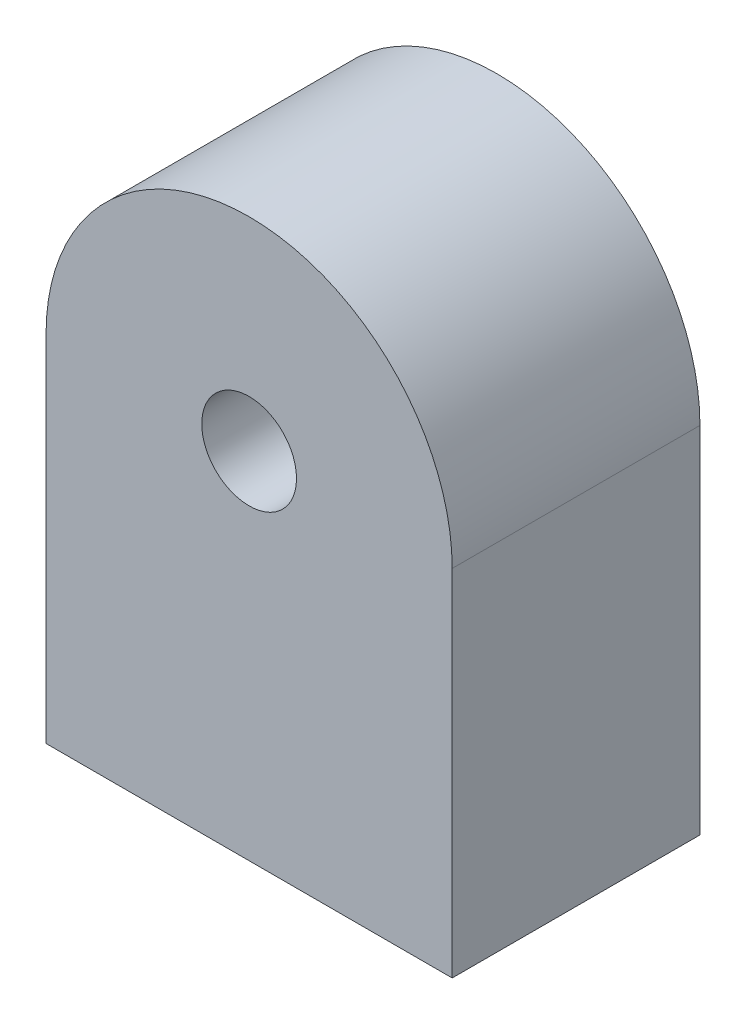
from build123d import *

# Parameters (mm, degrees)
BOSS_EXTRU_1_DEPTH      = 18.3
ESQUISSE2_W             = 14.5
ESQUISSE2_H             = 7.1
ENL_V_MAT_EXTRU_1_DEPTH = 1
ESQUISSE3_W             = 0.64
ESQUISSE3_H             = 0.64
BOSS_EXTRU_2_DEPTH      = 1
ESQUISSE4_R             = 3.5
ENL_V_MAT_EXTRU_2_DEPTH = 37.735541373


with BuildPart() as part:
    # Esquisse1 → Boss.-Extru.1 (new body)
    with BuildSketch(Plane.XY):
        with BuildLine():
            Line((-15, 13.1), (-15, -13.1))
            Line((-15, -13.1), (15, -13.1))
            Line((15, -13.1), (15, 13.1))
            ThreePointArc((15, 13.1), (0, 28.1), (-15, 13.1))
        make_face()
    extrude(amount=BOSS_EXTRU_1_DEPTH)

    # Esquisse2 → Enlèv. mat.-Extru.1 (cut)
    with BuildSketch(Plane.XZ.offset(13.1)):
        with Locations((0, 5.68)):
            Rectangle(ESQUISSE2_W, ESQUISSE2_H)
    extrude(amount=-ENL_V_MAT_EXTRU_1_DEPTH, mode=Mode.SUBTRACT)

    # Esquisse3 → Boss.-Extru.2 (add)
    with BuildSketch(Plane.XZ.offset(12.1)):
        with Locations((-5.08, 5.13)):
            Rectangle(ESQUISSE3_W, ESQUISSE3_H)
        with Locations((0, 5.13)):
            Rectangle(ESQUISSE3_W, ESQUISSE3_H)
        with Locations((2.54, 5.13)):
            Rectangle(ESQUISSE3_W, ESQUISSE3_H)
        with Locations((5.08, 5.13)):
            Rectangle(ESQUISSE3_W, ESQUISSE3_H)
        with Locations((-2.54, 5.13)):
            Rectangle(ESQUISSE3_W, ESQUISSE3_H)
    extrude(amount=BOSS_EXTRU_2_DEPTH)

    # Esquisse4 → Enlèv. mat.-Extru.2 (cut, through all)
    with BuildSketch(Plane.XY.offset(18.3)):
        with Locations((0, 13.1)):
            Circle(ESQUISSE4_R)
    extrude(amount=-ENL_V_MAT_EXTRU_2_DEPTH, mode=Mode.SUBTRACT)


solid = part.part
